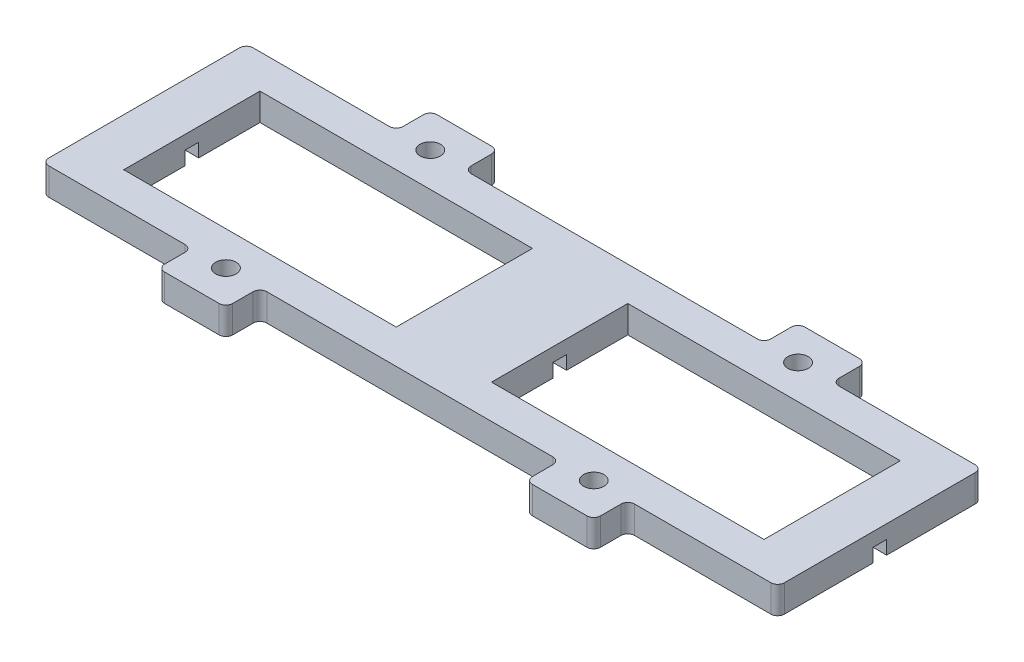
from build123d import *

# Parameters (mm, degrees)
SKETCH_2_W          = 10
SKETCH_2_H          = 5
SKETCH_2_W_2        = 108
SKETCH_2_H_2        = 30
EXTRUDE_1_DEPTH     = 4
SKETCH_3_R          = 1.5
SKETCH_3_W          = 94
SKETCH_3_H          = 20
CUT_EXTRUDE_1_DEPTH = 58.723478759
FILLET_1_R          = 1
SKETCH_4_W          = 14
SKETCH_4_H          = 20
EXTRUDE_2_DEPTH     = 4
SKETCH_6_W          = 7
SKETCH_6_H          = 2
SKETCH_6_W_2        = 14
CUT_EXTRUDE_3_DEPTH = 2


with BuildPart() as part:
    # 草图2 → 凸台-拉伸1 (new body)
    with BuildSketch(Plane(origin=(0, 0, 0), x_dir=(1, 0, 0), z_dir=(0, 1, 0))):
        with Locations((27, 17.5)):
            Rectangle(SKETCH_2_W, SKETCH_2_H)
        with Locations((-27, 17.5)):
            Rectangle(SKETCH_2_W, SKETCH_2_H)
        with Locations((-27, -17.5)):
            Rectangle(SKETCH_2_W, SKETCH_2_H)
        with Locations((27, -17.5)):
            Rectangle(SKETCH_2_W, SKETCH_2_H)
        Rectangle(SKETCH_2_W_2, SKETCH_2_H_2)
    extrude(amount=EXTRUDE_1_DEPTH)

    # 草图3 → 切除-拉伸1 (cut, through all)
    with BuildSketch(Plane.XZ):
        with Locations(Location((-27, 15, 0), (0, 0, 270))):
            Circle(SKETCH_3_R)
        with Locations(Location((27, 15, 0), (0, 0, 90))):
            Circle(SKETCH_3_R)
        with Locations(Location((27, -15, 0), (0, 0, 270))):
            Circle(SKETCH_3_R)
        with Locations(Location((-27, -15, 0), (0, 0, 90))):
            Circle(SKETCH_3_R)
        Rectangle(SKETCH_3_W, SKETCH_3_H)
    extrude(amount=-CUT_EXTRUDE_1_DEPTH, mode=Mode.SUBTRACT)

    # 圆角1
    fillet_1_edges = [part.edges().sort_by_distance(p)[0] for p in [
        (32, 2, -15),
        (54, 2, -15),
        (54, 2, 15),
        (32, 2, 15),
        (32, 2, 20),
        (22, 2, 20),
        (22, 2, 15),
        (-22, 2, 15),
        (-22, 2, 20),
        (-32, 2, 20),
        (-32, 2, 15),
        (-54, 2, 15),
        (-54, 2, -15),
        (-32, 2, -15),
        (-32, 2, -20),
        (-22, 2, -20),
        (-22, 2, -15),
        (22, 2, -15),
        (22, 2, -20),
        (32, 2, -20),
    ]]
    fillet(fillet_1_edges, radius=FILLET_1_R)

    # 草图4 → 凸台-拉伸2 (add)
    with BuildSketch(Plane(origin=(0, 0, 0), x_dir=(1, 0, 0), z_dir=(0, 1, 0))):
        Rectangle(SKETCH_4_W, SKETCH_4_H)
    extrude(amount=EXTRUDE_2_DEPTH)

    # 草图6 → 切除-拉伸3 (cut)
    with BuildSketch(Plane.XZ):
        with Locations((-50.5, 0)):
            Rectangle(SKETCH_6_W, SKETCH_6_H)
        Rectangle(SKETCH_6_W_2, SKETCH_6_H)
        with Locations((50.5, 0)):
            Rectangle(SKETCH_6_W, SKETCH_6_H)
    extrude(amount=-CUT_EXTRUDE_3_DEPTH, mode=Mode.SUBTRACT)


solid = part.part
